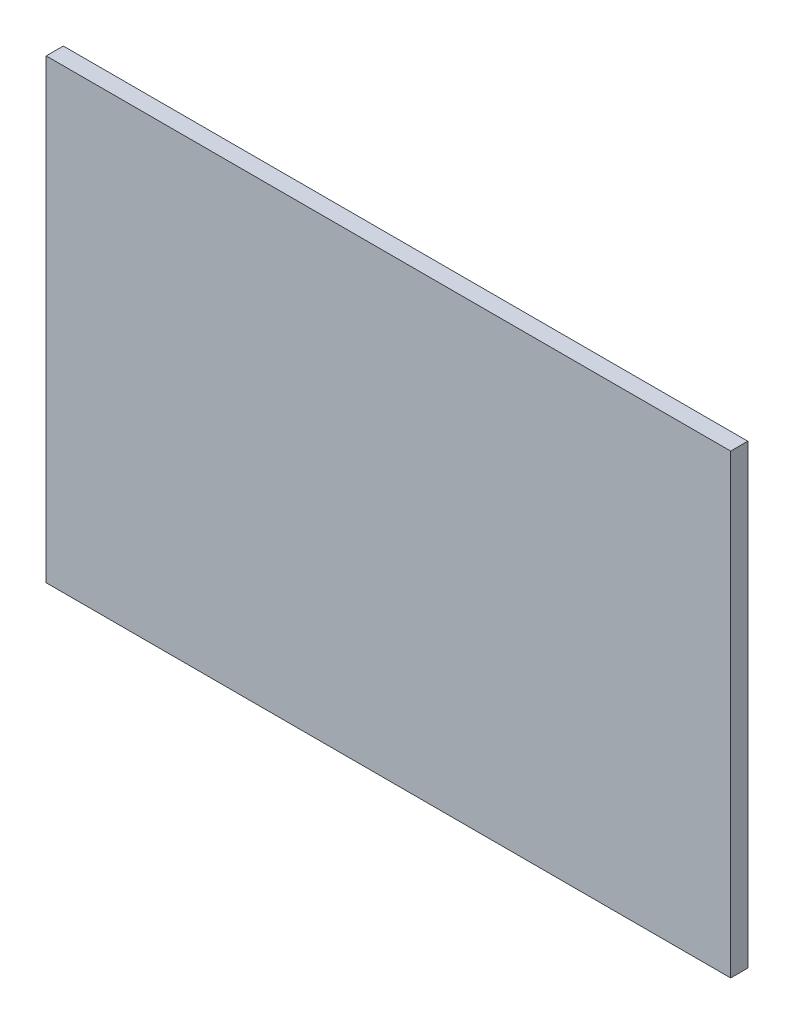
from build123d import *

# Parameters (mm, degrees)
SKETCH1_W           = 600
SKETCH1_H           = 400
BOSS_EXTRUDE1_DEPTH = 15


with BuildPart() as part:
    # Sketch1 → Boss-Extrude1 (new body)
    with BuildSketch(Plane.XY):
        Rectangle(SKETCH1_W, SKETCH1_H)
    extrude(amount=BOSS_EXTRUDE1_DEPTH)


solid = part.part
